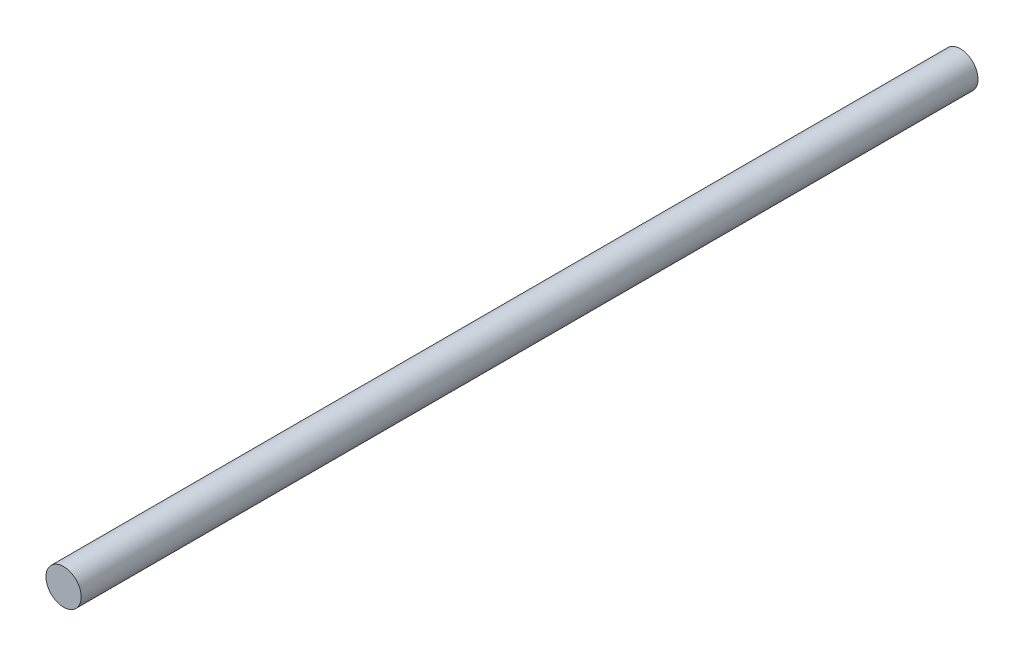
from build123d import *

# Parameters (mm, degrees)
SKETCH_1_R      = 2.75
EXTRUDE_1_DEPTH = 140


with BuildPart() as part:
    # ｽｹｯﾁ1 → ﾎﾞｽ - 押し出し1 (new body)
    with BuildSketch(Plane.XY):
        Circle(SKETCH_1_R)
    extrude(amount=EXTRUDE_1_DEPTH)


solid = part.part
